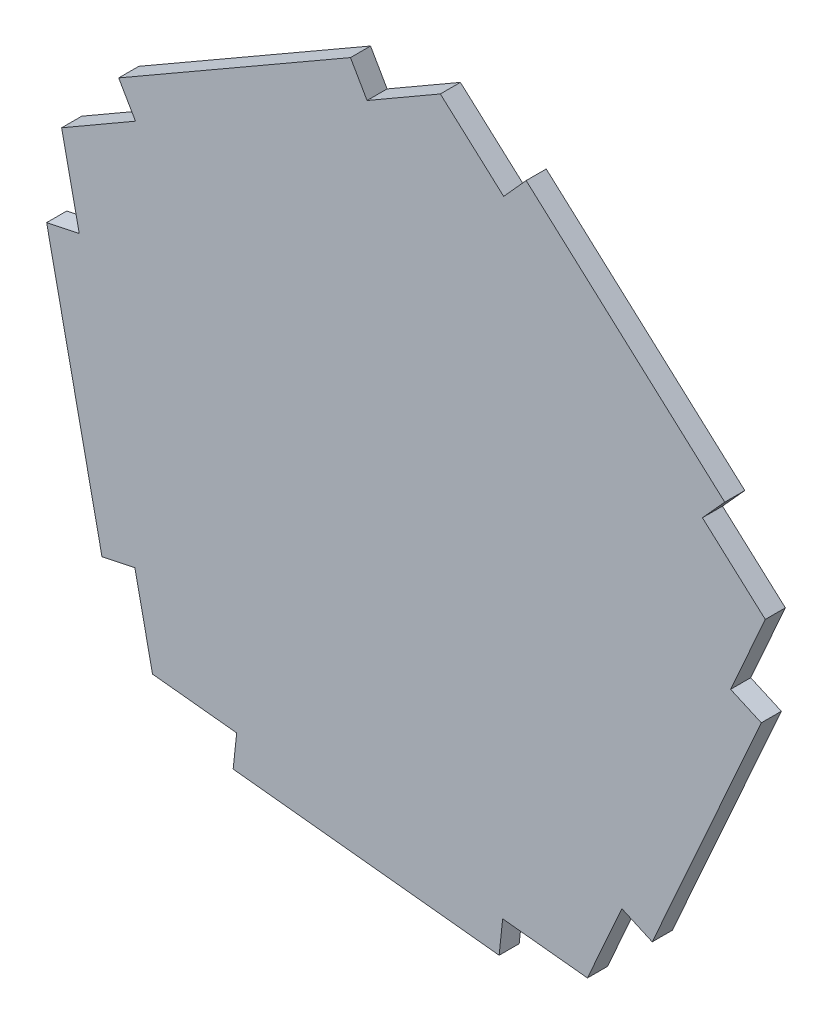
from build123d import *

# Parameters (mm, degrees)
BOSS_EXTRUDE1_DEPTH = 3
CUT_EXTRUDE3_DEPTH  = 10


with BuildPart() as part:
    # Sketch1 → Boss-Extrude1 (new body)
    with BuildSketch(Plane.XY):
        Polygon((-41.404007678, -45.884292091), (30.844012981, -53.556577334), (60.46665605, 12.784506978), (6.526435644, 61.457837175), (-56.433096997, 25.198525272), align=None)
    extrude(amount=BOSS_EXTRUDE1_DEPTH)

    # Sketch4 → Cut-Extrude3 (cut)
    with BuildSketch(Plane.XY.offset(3)):
        Polygon((-50.814192878, 22.62393629), (-39.77384321, 28.998085143), (-42.284603166, 33.346848953), (-56.433096997, 25.198525272), (-53.055705701, 9.224537525), (-48.18384365, 10.249116114), align=None)
        Polygon((5.814192878, 55.31835005), (15.288024352, 46.788073876), (18.648077016, 50.519790415), (6.526435644, 61.457837175), (-7.622058187, 53.309513494), (-5.142137875, 48.99270954), align=None)
        Polygon((54.407561694, 11.564684243), (49.22236188, -0.08146522), (53.809748587, -2.123901372), (60.46665605, 12.784506978), (48.345014677, 23.722553738), (45.005827668, 20.030043583), align=None)
        Polygon((37.500920444, -38.648168984), (32.957269066, -36.61346181), (27.811529494, -48.170982119), (15.133068296, -46.838422151), (14.608176536, -51.832433652), (30.844012981, -53.556577334), align=None)
        Polygon((-25.168171234, -47.608435773), (-24.637115209, -42.658407427), (-37.219091188, -41.335988464), (-39.869611319, -28.866271649), (-44.781398973, -29.910304344), (-41.404007678, -45.884292091), align=None)
    extrude(amount=-CUT_EXTRUDE3_DEPTH, mode=Mode.SUBTRACT)


solid = part.part
